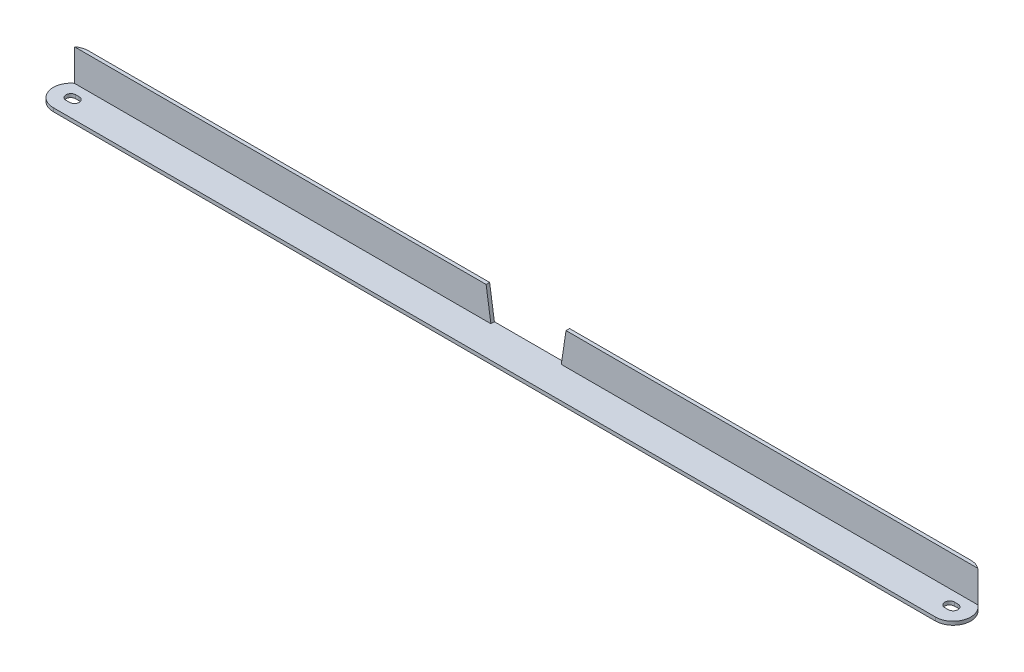
from build123d import *

# Parameters (mm, degrees)
BOSS_EXTRUDE1_DEPTH = 270
CUT_EXTRUDE1_DEPTH  = 271.370116692
CUT_EXTRUDE2_DEPTH  = 262.462086162


with BuildPart() as part:
    # Sketch1 → Boss-Extrude1 (new, symmetric)
    with BuildSketch(Plane(origin=(0, 0, 0), x_dir=(0, 0, -1), z_dir=(1, 0, 0))):
        Polygon((8, 10), (10, 10), (10, -10), (-10, -10), (-10, -8), (8, -8), align=None)
    extrude(amount=BOSS_EXTRUDE1_DEPTH, both=True)

    # Sketch2 → Cut-Extrude1 (cut, symmetric)
    with BuildSketch(Plane(origin=(0, 0, 0), x_dir=(1, 0, 0), z_dir=(0, 1, 0))):
        with BuildLine():
            Line((248.65, 2.75), (250.65, 2.75))
            ThreePointArc((250.65, 2.75), (253.4, 0), (250.65, -2.75))
            Line((250.65, -2.75), (248.65, -2.75))
            ThreePointArc((248.65, -2.75), (245.9, 0), (248.65, 2.75))
        make_face()
        with BuildLine():
            ThreePointArc((250.65, -10), (260.65, 0), (250.65, 10))
            Line((250.65, 10), (270, 10))
            Line((270, 10), (270, -10))
            Line((270, -10), (250.65, -10))
        make_face()
    cut_extrude1 = extrude(amount=CUT_EXTRUDE1_DEPTH, both=True, mode=Mode.SUBTRACT)

    # Mirror1: Cut-Extrude1 across plane
    add(cut_extrude1.mirror(Plane(origin=(0, 0, 0), x_dir=(0, 0, 1), z_dir=(1, 0, 0))), mode=Mode.SUBTRACT)

    # Sketch3 → Cut-Extrude2 (cut, through all)
    with BuildSketch(Plane.XY.offset(-8)):
        Polygon((-20, -8), (20, -8), (22.706021628, 10), (-22.706021628, 10), align=None)
    extrude(amount=-CUT_EXTRUDE2_DEPTH, mode=Mode.SUBTRACT)


solid = part.part
